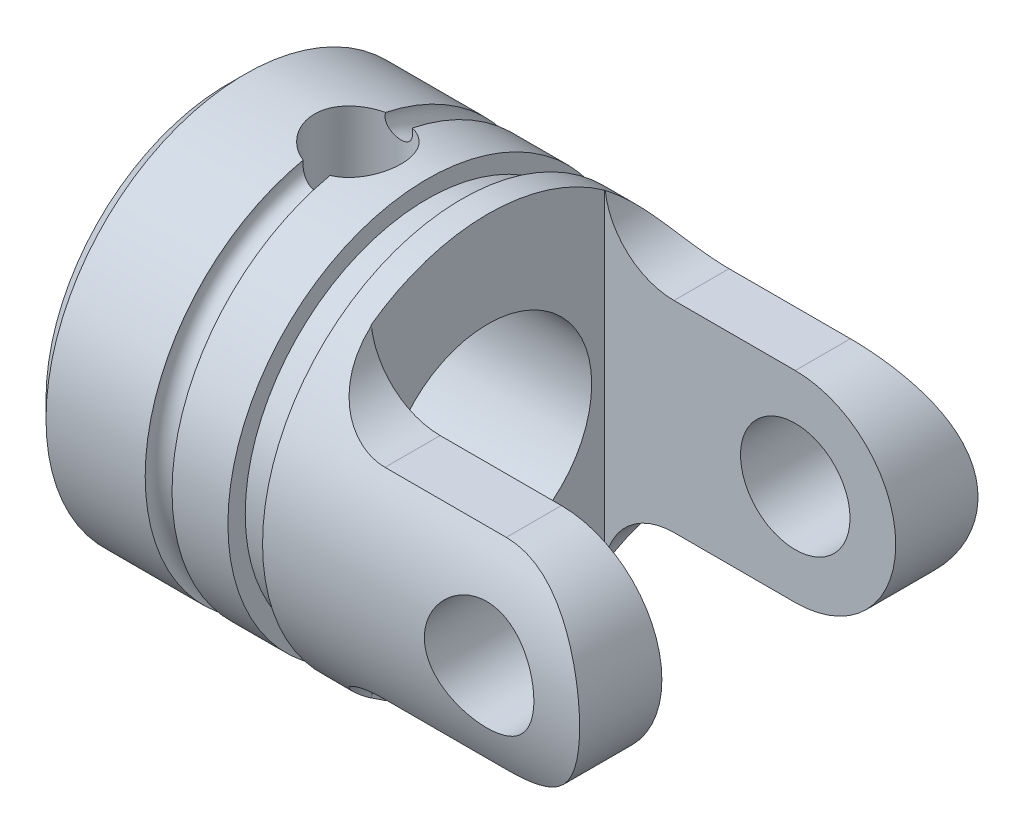
from build123d import *

# Parameters (mm, degrees)
CUT_EXTRUDE1_DEPTH      = 23
CUT_EXTRUDE1_DEPTH_BACK = 23
CUT_EXTRUDE2_DEPTH      = 23
CUT_EXTRUDE2_DEPTH_BACK = 23
SKETCH3_W               = 26
SKETCH3_H               = 13.5
SKETCH4_W               = 23
SKETCH4_H               = 3.16
SKETCH5_W               = 2.5
SKETCH5_H               = 23


with BuildPart() as part:
    # Sketch1 → Revolve1 (revolve)
    with BuildSketch(Plane.XY):
        with BuildLine():
            Line((0, 10.5), (0, 7))
            Line((0, 7), (1, 6))
            Line((1, 6), (31.8, 6))
            Line((31.8, 6), (31.8, 11.5))
            Line((31.8, 11.5), (13.5, 11.5))
            Line((13.5, 11.5), (13.5, 10.5))
            Line((13.5, 10.5), (11.5, 10.5))
            Line((11.5, 10.5), (11.5, 11.5))
            Line((11.5, 11.5), (8.274596669, 11.5))
            ThreePointArc((8.274596669, 11.5), (7.5, 10.5), (6.725403331, 11.5))
            Line((6.725403331, 11.5), (1, 11.5))
            Line((1, 11.5), (0, 10.5))
        make_face()
    revolve(axis=Axis((31.8, 0, 0), (-1, 0, 0)))

    # Sketch2 → Cut-Extrude1 (cut, two sides: drawn at the far end of the back side and taken through both)
    with BuildSketch(Plane.XY.offset(-CUT_EXTRUDE1_DEPTH_BACK)):
        with BuildLine():
            Line((15, 12.5), (15, 9.8))
            ThreePointArc((15, 9.8), (16.171572875, 6.971572875), (19, 5.8))
            Line((19, 5.8), (26, 5.8))
            ThreePointArc((26, 5.8), (31.8, 0), (26, -5.8))
            Line((26, -5.8), (19, -5.8))
            ThreePointArc((19, -5.8), (16.171572875, -6.971572875), (15, -9.8))
            Line((15, -9.8), (15, -12.5))
            Line((15, -12.5), (41, -12.5))
            Line((41, -12.5), (41, 12.5))
            Line((41, 12.5), (15, 12.5))
        make_face()
    extrude(amount=CUT_EXTRUDE1_DEPTH + CUT_EXTRUDE1_DEPTH_BACK, mode=Mode.SUBTRACT)

    # Sketch3 → Cut-Extrude2 (cut, two sides: drawn at the far end of the back side and taken through both)
    with BuildSketch(Plane(origin=(0, 0, 0), x_dir=(1, 0, 0), z_dir=(0, 1, 0)).offset(-CUT_EXTRUDE2_DEPTH_BACK)):
        with Locations((28, 0)):
            Rectangle(SKETCH3_W, SKETCH3_H)
    extrude(amount=CUT_EXTRUDE2_DEPTH + CUT_EXTRUDE2_DEPTH_BACK, mode=Mode.SUBTRACT)

    # Sketch4 → Cut-Revolve1 (revolve, cut)
    with BuildSketch(Plane(origin=(26, 0, 0), x_dir=(0, 0, -1), z_dir=(1, 0, 0))):
        with Locations((0, 1.58)):
            Rectangle(SKETCH4_W, SKETCH4_H)
    revolve(axis=Axis((26, 0, -11.5), (0, 0, 1)), mode=Mode.SUBTRACT)

    # Sketch5 → Cut-Revolve2 (revolve, cut)
    with BuildSketch(Plane(origin=(7.5, 0, 0), x_dir=(0, 0, -1), z_dir=(1, 0, 0))):
        with Locations((1.25, 0)):
            Rectangle(SKETCH5_W, SKETCH5_H)
    revolve(axis=Axis((7.5, -11.5, 0), (0, 1, 0)), mode=Mode.SUBTRACT)


solid = part.part
